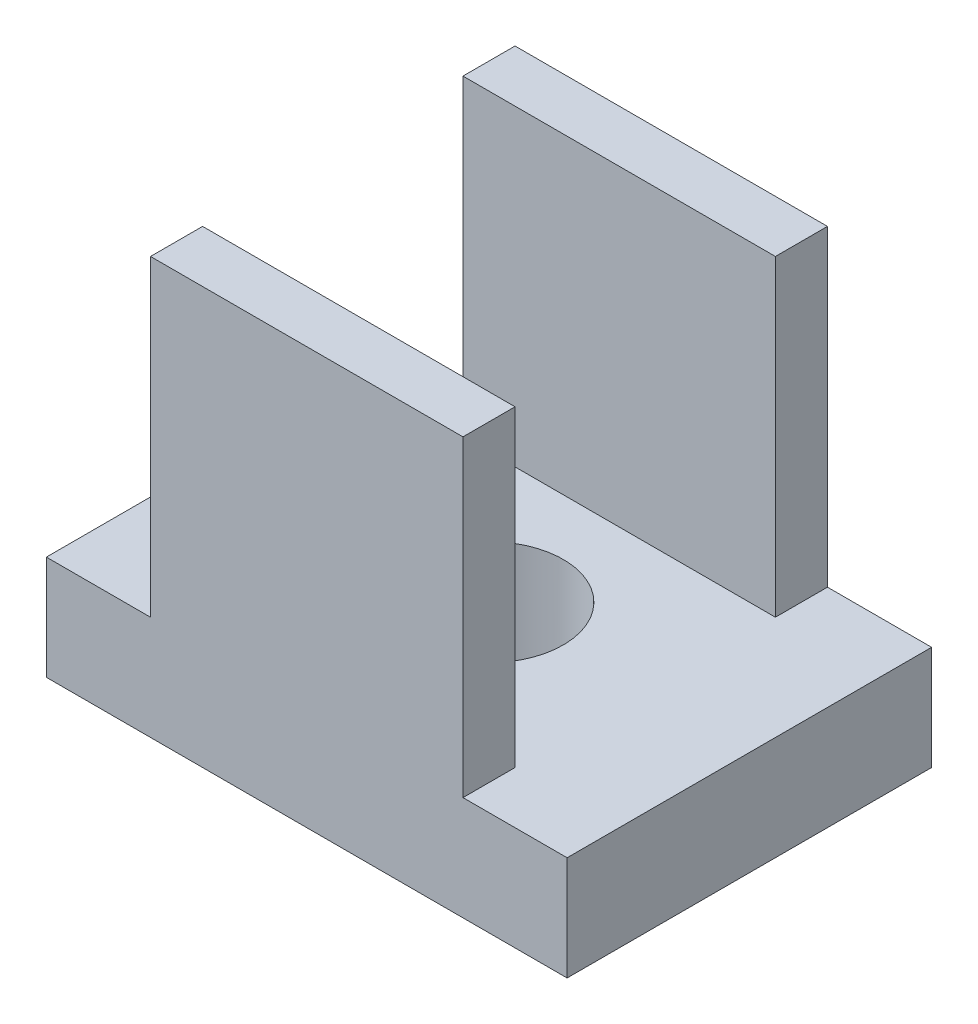
from build123d import *

# Parameters (mm, degrees)
SKETCH1_W           = 10
SKETCH1_H           = 7
BOSS_EXTRUDE1_DEPTH = 2
CUT_EXTRUDE2_REACH  = 8.423
SKETCH2_R           = 1.425
SKETCH3_W           = 6
SKETCH3_H           = 1
BOSS_EXTRUDE2_DEPTH = 6


with BuildPart() as part:
    # Sketch1 → Boss-Extrude1 (new body)
    with BuildSketch(Plane(origin=(0, 0, 0), x_dir=(1, 0, 0), z_dir=(0, 1, 0))):
        Rectangle(SKETCH1_W, SKETCH1_H)
    extrude(amount=BOSS_EXTRUDE1_DEPTH)

    # Sketch2 → Cut-Extrude2 (cut, up to next)
    with BuildSketch(Plane(origin=(0, 2, 0), x_dir=(1, 0, 0), z_dir=(0, 1, 0)), mode=Mode.PRIVATE) as cut_extrude2_sk1:
        with Locations(Location((0, 0, 0), (0, 0, 270))):
            Circle(SKETCH2_R)
    cut_extrude2_tool1 = extrude(cut_extrude2_sk1.sketch, amount=-CUT_EXTRUDE2_REACH, mode=Mode.PRIVATE) & part.part
    add(cut_extrude2_tool1.solids().sort_by_distance((0, 2, 0))[0], mode=Mode.SUBTRACT)

    # Sketch3 → Boss-Extrude2 (add)
    with BuildSketch(Plane(origin=(0, 2, 0), x_dir=(1, 0, 0), z_dir=(0, 1, 0))):
        with Locations((0, 3)):
            Rectangle(SKETCH3_W, SKETCH3_H)
        with Locations((0, -3)):
            Rectangle(SKETCH3_W, SKETCH3_H)
    extrude(amount=BOSS_EXTRUDE2_DEPTH)


solid = part.part
